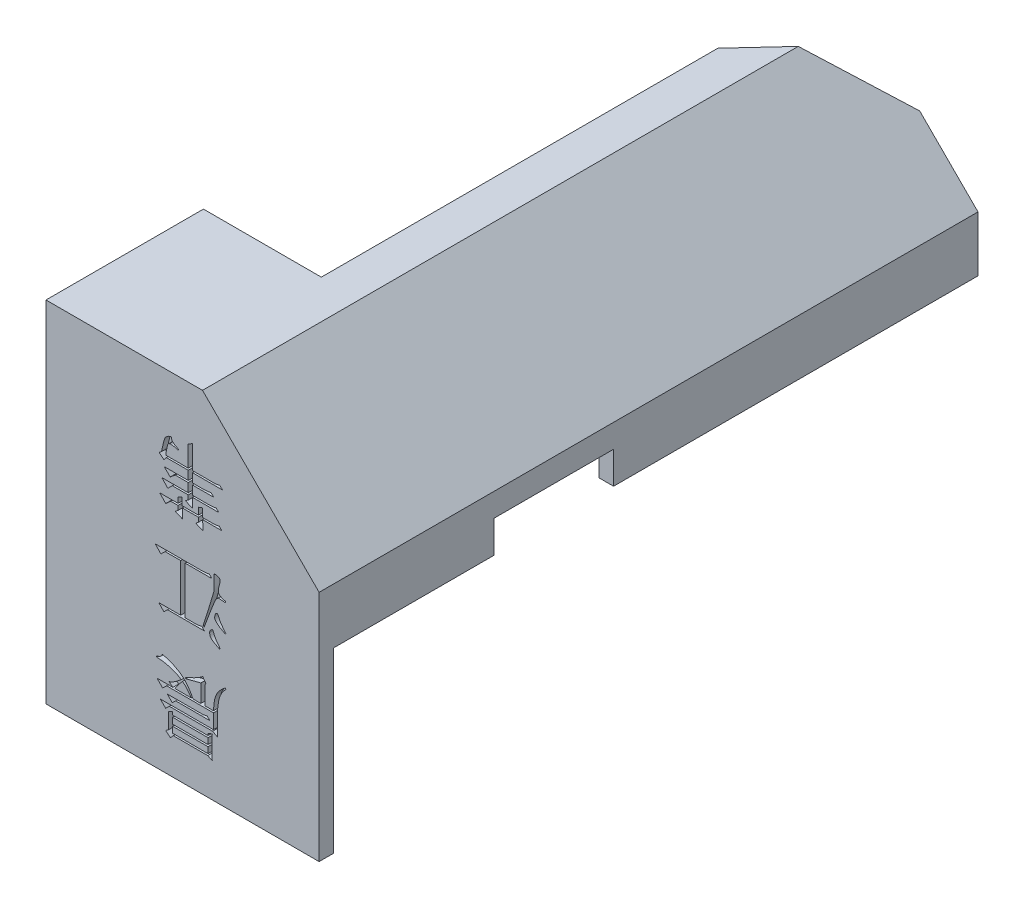
from build123d import *

# Parameters (mm, degrees)
EXTRUDE_1_DEPTH     = 10
CUT_EXTRUDE_1_DEPTH = 200
EXTRUDE_2_DEPTH     = 200
CUT_EXTRUDE_2_DEPTH = 200
SKETCH_6_W          = 16.619995117
SKETCH_6_H          = 27
EXTRUDE_3_DEPTH     = 10
SKETCH_7_W          = 3.6
SKETCH_7_H          = 27
EXTRUDE_4_DEPTH     = 20
CUT_EXTRUDE_3_DEPTH = 200
EXTRUDE_5_DEPTH     = 200
SKETCH_10_W         = 10.760009765
SKETCH_10_H         = 87
CUT_EXTRUDE_4_DEPTH = 200
CUT_EXTRUDE_5_DEPTH = 200
SKETCH_13_W         = 46.839990234
SKETCH_13_H         = 2.5
EXTRUDE_6_DEPTH     = 40
SKETCH_14_W         = 46.839990234
SKETCH_14_H         = 10
EXTRUDE_7_DEPTH     = 9.5
SKETCH_15_W         = 15
SKETCH_15_H         = 10
EXTRUDE_8_DEPTH     = 9.5
SKETCH_16_W         = 2.5
SKETCH_16_H         = 47.5
SKETCH_16_H_2       = 43
EXTRUDE_9_DEPTH     = 9.5
SKETCH_17_W         = 1.5
SKETCH_17_H         = 5
CUT_EXTRUDE_6_DEPTH = 9.5
SKETCH_18_W         = 2.5
SKETCH_18_H         = 20.5
CUT_EXTRUDE_7_DEPTH = 5.5
SKETCH_20_W         = 6.079056491
SKETCH_20_H         = 1.034164663
SKETCH_20_H_2       = 1.034164664
CUT_EXTRUDE_8_DEPTH = 1


with BuildPart() as part:
    # 草图2 → 凸台-拉伸1 (new body)
    with BuildSketch(Plane(origin=(0, 0, 0), x_dir=(1, 0, 0), z_dir=(0, 1, 0))):
        Polygon((23, -36), (23, -113), (-21, -113), (-21, -86), (-12, -86), (-12, -26.252704718), (12.239990234, 0), (23.04327774, 0), align=None)
    extrude(amount=EXTRUDE_1_DEPTH)

    # 草图3 → 切除-拉伸1 (cut)
    with BuildSketch(Plane(origin=(0, 0, 0), x_dir=(-1, 0, 0), z_dir=(0, 0, -1))):
        Polygon((-12.239990234, 10), (-23.04327774, 0), (-23.04327774, 10), align=None)
    extrude(amount=-CUT_EXTRUDE_1_DEPTH, mode=Mode.SUBTRACT)

    # 草图4 → 凸台-拉伸2 (add)
    with BuildSketch(Plane.XY.offset(113)):
        Polygon((-4.380004883, 10), (12.239990234, 10), (1.479980469, 20), (-4.380004883, 20), align=None)
    extrude(amount=-EXTRUDE_2_DEPTH)

    # 草图5 → 切除-拉伸2 (cut)
    with BuildSketch(Plane.XZ):
        Polygon((-4.380004883, 18), (12.239990234, 0), (12.239990234, -87), (-4.380004883, -87), align=None)
    extrude(amount=-CUT_EXTRUDE_2_DEPTH, mode=Mode.SUBTRACT)

    # 草图6 → 凸台-拉伸3 (add)
    with BuildSketch(Plane(origin=(0, 10, 0), x_dir=(1, 0, 0), z_dir=(0, 1, 0))):
        with Locations((-12.690002442, -99.5)):
            Rectangle(SKETCH_6_W, SKETCH_6_H)
    extrude(amount=EXTRUDE_3_DEPTH)

    # 草图7 → 凸台-拉伸4 (add)
    with BuildSketch(Plane(origin=(0, 0, 0), x_dir=(-1, 0, 0), z_dir=(0, -1, 0))):
        with Locations((22.8, -99.5)):
            Rectangle(SKETCH_7_W, SKETCH_7_H)
    extrude(amount=-EXTRUDE_4_DEPTH)

    # 草图8 → 切除-拉伸3 (cut)
    with BuildSketch(Plane(origin=(0, 0, 0), x_dir=(-1, 0, 0), z_dir=(0, 0, -1))):
        Polygon((-22.239990234, 0), (-12.239990234, 10), (-23.04327774, 0), align=None)
    extrude(amount=-CUT_EXTRUDE_3_DEPTH, mode=Mode.SUBTRACT)

    # 草图9 → 凸台-拉伸5 (add)
    with BuildSketch(Plane(origin=(0, 0, 0), x_dir=(-1, 0, 0), z_dir=(0, 0, -1))):
        Polygon((-2.239990234, 20), (-12.239990234, 10), (-1.479980469, 20), align=None)
    extrude(amount=-EXTRUDE_5_DEPTH)

    # 草图10 → 切除-拉伸4 (cut)
    with BuildSketch(Plane.XZ):
        with Locations((6.859985352, 156.5)):
            Rectangle(SKETCH_10_W, SKETCH_10_H)
    extrude(amount=-CUT_EXTRUDE_4_DEPTH, mode=Mode.SUBTRACT)

    # 草图12 → 切除-拉伸5 (cut)
    with BuildSketch(Plane.XZ):
        Polygon((12.239990234, 0), (1.479980469, 0), (1.479980469, 11.653443603), align=None)
    extrude(amount=-CUT_EXTRUDE_5_DEPTH, mode=Mode.SUBTRACT)

    # 草图13 → 凸台-拉伸6 (add)
    with BuildSketch(Plane.XZ):
        with Locations((-1.180004883, 111.75)):
            Rectangle(SKETCH_13_W, SKETCH_13_H)
    extrude(amount=EXTRUDE_6_DEPTH)

    # 草图14 → 凸台-拉伸7 (add)
    with BuildSketch(Plane.XZ):
        with Locations((-1.180004883, 105.5)):
            Rectangle(SKETCH_14_W, SKETCH_14_H)
    extrude(amount=EXTRUDE_7_DEPTH)

    # 草图15 → 凸台-拉伸8 (add)
    with BuildSketch(Plane.XZ):
        with Locations((14.739990234, 48)):
            Rectangle(SKETCH_15_W, SKETCH_15_H)
    extrude(amount=EXTRUDE_8_DEPTH)

    # 草图16 → 凸台-拉伸9 (add)
    with BuildSketch(Plane.XZ):
        with Locations((20.989990234, 76.75)):
            Rectangle(SKETCH_16_W, SKETCH_16_H)
        with Locations((20.989990234, 21.5)):
            Rectangle(SKETCH_16_W, SKETCH_16_H_2)
    extrude(amount=EXTRUDE_9_DEPTH)

    # 草图17 → 切除-拉伸6 (cut)
    with BuildSketch(Plane.XZ.offset(9.5)):
        with Locations((20.489990234, 2.5)):
            Rectangle(SKETCH_17_W, SKETCH_17_H)
    extrude(amount=-CUT_EXTRUDE_6_DEPTH, mode=Mode.SUBTRACT)

    # 草图18 → 切除-拉伸7 (cut)
    with BuildSketch(Plane(origin=(0, -9.5, 0), x_dir=(-1, 0, 0), z_dir=(0, -1, 0))):
        with Locations((-20.989990234, -72.75)):
            Rectangle(SKETCH_18_W, SKETCH_18_H)
    extrude(amount=-CUT_EXTRUDE_7_DEPTH, mode=Mode.SUBTRACT)

    # 草图20 → 切除-拉伸8 (cut)
    # profile 1 of 9: a face of its own
    with BuildSketch(Plane.XY.offset(113)):
        with BuildLine():
            Line((-1.957855817, 1.113671032), (-1.957855817, 2.092502162))
            Line((-1.957855817, 2.092502162), (-1.236611827, 2.401606729))
            Line((-1.236611827, 2.401606729), (-1.236611827, 1.113671032))
            Line((-1.236611827, 1.113671032), (1.545329279, 1.113671032))
            Line((1.545329279, 1.113671032), (1.545329279, 2.298571873))
            Line((1.545329279, 2.298571873), (2.26657327, 2.556159013))
            Line((2.26657327, 2.556159013), (2.26657327, 1.113671032))
            Line((2.26657327, 1.113671032), (3.863613534, 1.113671032))
            add(Edge.make_bspline(
                [(3.863613534, 1.113671032), (3.973067336, 1.115494854), (4.188542389, 1.119085303), (4.504865126, 1.147595553), (4.808234957, 1.197119636), (5.0036207, 1.244730313), (5.100031803, 1.268223316)],
                knots=[0, 0, 0, 0, 1.051063684, 2.069165233, 3.04724927, 4, 4, 4, 4], degree=3))
            Line((5.100031803, 1.268223316), (5.563688654, 0.804566465))
            Line((5.563688654, 0.804566465), (2.26657327, 0.804566465))
            add(Edge.make_bspline(
                [(2.26657327, 0.804566465), (2.269095531, 0.534835012), (2.274225696, -0.013786449), (2.303307204, -0.561663521), (2.318090697, -0.840175122)],
                knots=[0, 0, 0, 0, 0.98330624, 2, 2, 2, 2], degree=3))
            Line((2.318090697, -0.840175122), (1.081672428, -0.30973642))
            Line((1.081672428, -0.30973642), (1.545329279, 0.062333893))
            Line((1.545329279, 0.062333893), (1.545329279, 0.804566465))
            Line((1.545329279, 0.804566465), (-1.236611827, 0.804566465))
            add(Edge.make_bspline(
                [(-1.236611827, 0.804566465), (-1.234089565, 0.534835012), (-1.2289594, -0.013786449), (-1.199877892, -0.561663521), (-1.185094399, -0.840175122)],
                knots=[0, 0, 0, 0, 0.98330624, 2, 2, 2, 2], degree=3))
            Line((-1.185094399, -0.840175122), (-2.421512668, -0.30973642))
            Line((-2.421512668, -0.30973642), (-1.957855817, 0.062333893))
            Line((-1.957855817, 0.062333893), (-1.957855817, 0.804566465))
            Line((-1.957855817, 0.804566465), (-3.194274086, 0.804566465))
            Line((-3.194274086, 0.804566465), (-4.07007036, 0.031805046))
            Line((-4.07007036, 0.031805046), (-5.100418918, 1.113671032))
            Line((-5.100418918, 1.113671032), (-1.957855817, 1.113671032))
        make_face()
    # profile 2 of 9: a face of its own
    with BuildSketch(Plane.XY.offset(113)):
        with BuildLine():
            add(Edge.make_bspline(
                [(-0.206263269, 7.219440263), (-0.205870723, 7.433779465), (-0.205119405, 7.844017379), (-0.210217646, 8.431053974), (-0.213258354, 8.961502492), (-0.218651091, 9.435352439), (-0.227179841, 9.852551152), (-0.233019268, 10.213264847), (-0.245196914, 10.51724242), (-0.253875898, 10.701005451), (-0.257780697, 10.783683051)],
                knots=[0, 0, 0, 0, 1.442975, 2.761804882, 3.952183016, 5.014153289, 5.952029349, 6.761475481, 7.442770207, 8, 8, 8, 8], degree=3))
            Line((-0.257780697, 10.783683051), (0.566498149, 11.249247955))
            add(Edge.make_bspline(
                [(0.566498149, 11.249247955), (0.562689346, 11.122680818), (0.554727523, 10.858108227), (0.54210012, 10.443474928), (0.536114344, 9.993108749), (0.527597456, 9.507215646), (0.522046289, 8.985670372), (0.519025417, 8.428509185), (0.513872982, 7.835749029), (0.514604619, 7.428691283), (0.514980722, 7.219440263)],
                knots=[0, 0, 0, 0, 0.7540346, 1.576213955, 2.470168138, 3.436073309, 4.47009525, 5.576041255, 6.753946228, 8, 8, 8, 8], degree=3))
            Line((0.514980722, 7.219440263), (3.96664839, 7.219440263))
            add(Edge.make_bspline(
                [(3.96664839, 7.219440263), (4.076102192, 7.221264085), (4.291577245, 7.224854534), (4.607899982, 7.253364784), (4.911269813, 7.302888867), (5.106655556, 7.350499544), (5.203066659, 7.373992546)],
                knots=[0, 0, 0, 0, 1.051063684, 2.069165233, 3.04724927, 4, 4, 4, 4], degree=3))
            Line((5.203066659, 7.373992546), (5.66672351, 6.910335695))
            Line((5.66672351, 6.910335695), (0.514980722, 6.910335695))
            Line((0.514980722, 6.910335695), (0.514980722, 5.387709494))
            Line((0.514980722, 5.387709494), (2.472642981, 5.387709494))
            add(Edge.make_bspline(
                [(2.472642981, 5.387709494), (2.582096784, 5.389533316), (2.797571836, 5.393123764), (3.113894573, 5.421634015), (3.417264404, 5.471158098), (3.612650147, 5.518768774), (3.70906125, 5.542261777)],
                knots=[0, 0, 0, 0, 1.051063684, 2.069165233, 3.04724927, 4, 4, 4, 4], degree=3))
            Line((3.70906125, 5.542261777), (4.172718101, 5.078604926))
            Line((4.172718101, 5.078604926), (0.514980722, 5.078604926))
            Line((0.514980722, 5.078604926), (0.514980722, 3.555978724))
            Line((0.514980722, 3.555978724), (3.348439255, 3.555978724))
            add(Edge.make_bspline(
                [(3.348439255, 3.555978724), (3.457893058, 3.557802547), (3.67336811, 3.561392995), (3.989690847, 3.589903246), (4.293060678, 3.639427329), (4.488446422, 3.687038005), (4.584857524, 3.710531008)],
                knots=[0, 0, 0, 0, 1.051063684, 2.069165233, 3.04724927, 4, 4, 4, 4], degree=3))
            Line((4.584857524, 3.710531008), (5.048514375, 3.246874157))
            Line((5.048514375, 3.246874157), (0.514980722, 3.246874157))
            Line((0.514980722, 3.246874157), (0.514980722, 1.598316465))
            Line((0.514980722, 1.598316465), (-0.721437548, 2.165008171))
            Line((-0.721437548, 2.165008171), (-0.206263269, 2.474112739))
            Line((-0.206263269, 2.474112739), (-0.206263269, 3.246874157))
            Line((-0.206263269, 3.246874157), (-2.936686947, 3.246874157))
            Line((-2.936686947, 3.246874157), (-3.709448365, 2.474112739))
            Line((-3.709448365, 2.474112739), (-4.739796923, 3.555978724))
            Line((-4.739796923, 3.555978724), (-0.206263269, 3.555978724))
            Line((-0.206263269, 3.555978724), (-0.206263269, 5.078604926))
            Line((-0.206263269, 5.078604926), (-2.421512668, 5.078604926))
            Line((-2.421512668, 5.078604926), (-3.297308942, 4.357360936))
            Line((-3.297308942, 4.357360936), (-4.3276575, 5.387709494))
            Line((-4.3276575, 5.387709494), (-0.206263269, 5.387709494))
            Line((-0.206263269, 5.387709494), (-0.206263269, 6.910335695))
            Line((-0.206263269, 6.910335695), (-3.967035504, 6.910335695))
            Line((-3.967035504, 6.910335695), (-4.379174928, 6.395161417))
            Line((-4.379174928, 6.395161417), (-5.203453774, 7.064887979))
            Line((-5.203453774, 7.064887979), (-4.791314351, 7.373992546))
            add(Edge.make_bspline(
                [(-4.791314351, 7.373992546), (-4.762188337, 7.533783173), (-4.706845462, 7.837404285), (-4.616277009, 8.267126012), (-4.529950112, 8.649351182), (-4.442292905, 8.982659269), (-4.357905358, 9.26857651), (-4.272140077, 9.505411195), (-4.191108098, 9.696211656), (-4.103897825, 9.843655548), (-4.00912782, 9.958389637), (-3.909624168, 10.059101335), (-3.798268819, 10.146672934), (-3.677438605, 10.223330121), (-3.546532521, 10.289014907), (-3.404119408, 10.341490402), (-3.252142391, 10.386739086), (-3.145554374, 10.404480247), (-3.09123923, 10.413520792)],
                knots=[0, 0, 0, 0, 2.069553596, 3.932396895, 5.595591764, 7.062035983, 8.32345808, 9.392529406, 10.270536713, 10.961312947, 11.566325101, 12.162313655, 12.762256471, 13.367051464, 13.983197271, 14.624416805, 15.299030042, 16, 16, 16, 16], degree=3))
            add(Edge.make_bspline(
                [(-3.09123923, 10.413520792), (-3.091534706, 10.35469322), (-3.092126804, 10.236809591), (-3.041065968, 10.063490087), (-2.950854029, 9.899876078), (-2.818047606, 9.747794176), (-2.648636882, 9.602425738), (-2.437097764, 9.467477897), (-2.186699224, 9.340417545), (-2.003037868, 9.267180148), (-1.906338389, 9.22861995)],
                knots=[0, 0, 0, 0, 0.782883342, 1.568807377, 2.383007473, 3.263648648, 4.252173226, 5.358096433, 6.609012229, 8, 8, 8, 8], degree=3))
            Line((-1.906338389, 9.22861995), (-1.906338389, 9.022550239))
            add(Edge.make_bspline(
                [(-1.906338389, 9.022550239), (-1.976827784, 9.043290396), (-2.11229015, 9.083147607), (-2.309726039, 9.13452432), (-2.492304771, 9.178383921), (-2.660798556, 9.215174813), (-2.814818914, 9.243615133), (-2.95400287, 9.265532793), (-3.078940634, 9.277465398), (-3.157364849, 9.279282286), (-3.194274086, 9.280137378)],
                knots=[0, 0, 0, 0, 1.338869655, 2.5729608, 3.717076463, 4.760487723, 5.715229524, 6.570842299, 7.327387319, 8, 8, 8, 8], degree=3))
            add(Edge.make_bspline(
                [(-3.194274086, 9.280137378), (-3.235872356, 9.278090956), (-3.317390026, 9.274080704), (-3.434128911, 9.237823527), (-3.541002875, 9.181056173), (-3.62840401, 9.113308718), (-3.688729864, 9.018567802), (-3.735796521, 8.90038207), (-3.783035318, 8.735412133), (-3.836566406, 8.524168734), (-3.893523373, 8.266000472), (-3.949367168, 7.958854353), (-4.010796986, 7.605369563), (-4.049545142, 7.353080085), (-4.07007036, 7.219440263)],
                knots=[0, 0, 0, 0, 0.615964337, 1.207068884, 1.793788658, 2.409969795, 2.818244734, 3.443961849, 4.291755925, 5.362843938, 6.67702707, 8.21313856, 9.994068186, 12, 12, 12, 12], degree=3))
            Line((-4.07007036, 7.219440263), (-0.206263269, 7.219440263))
        make_face()
    # profile 3 of 9: a face of its own
    with BuildSketch(Plane.XY.offset(113)):
        with BuildLine():
            Line((2.575677837, -15.581971997), (-3.760965793, -15.581971997))
            Line((-3.760965793, -15.581971997), (-4.379174928, -16.200181131))
            Line((-4.379174928, -16.200181131), (-5.254971202, -15.27286743))
            Line((-5.254971202, -15.27286743), (-1.494198966, -15.27286743))
            Line((-1.494198966, -15.27286743), (-1.494198966, -7.156010458))
            Line((-1.494198966, -7.156010458), (-4.173105216, -7.156010458))
            Line((-4.173105216, -7.156010458), (-4.894349206, -7.877254449))
            Line((-4.894349206, -7.877254449), (-5.873180336, -6.846905891))
            Line((-5.873180336, -6.846905891), (2.163538414, -6.846905891))
            add(Edge.make_bspline(
                [(2.163538414, -6.846905891), (2.272992216, -6.845082069), (2.488467269, -6.84149162), (2.804790006, -6.81298137), (3.108159837, -6.763457287), (3.30354558, -6.71584661), (3.399956683, -6.692353607)],
                knots=[0, 0, 0, 0, 1.051063684, 2.069165233, 3.04724927, 4, 4, 4, 4], degree=3))
            Line((3.399956683, -6.692353607), (3.863613534, -7.156010458))
            Line((3.863613534, -7.156010458), (-0.721437548, -7.156010458))
            Line((-0.721437548, -7.156010458), (-0.721437548, -15.27286743))
            Line((-0.721437548, -15.27286743), (0.875602717, -15.27286743))
            add(Edge.make_bspline(
                [(0.875602717, -15.27286743), (0.985056519, -15.271043607), (1.200531572, -15.267453159), (1.516854309, -15.238942908), (1.82022414, -15.189418825), (2.015609883, -15.141808149), (2.112020986, -15.118315146)],
                knots=[0, 0, 0, 0, 1.051063684, 2.069165233, 3.04724927, 4, 4, 4, 4], degree=3))
            Line((2.112020986, -15.118315146), (2.575677837, -15.581971997))
        make_face()
    # profile 4 of 9: a face of its own
    with BuildSketch(Plane.XY.offset(113)):
        with BuildLine():
            add(Edge.make_bspline(
                [(2.318090697, -14.994291708), (2.38294259, -14.789487096), (2.508820791, -14.391959204), (2.692626711, -13.812747208), (2.864342424, -13.267676165), (3.023292276, -12.756336418), (3.176294289, -12.281070879), (3.31140346, -11.838564548), (3.441178154, -11.431681475), (3.555565234, -11.05814879), (3.664777937, -10.720285258), (3.756183521, -10.415224562), (3.841251925, -10.146095393), (3.913546773, -9.911338443), (3.975091485, -9.710501499), (4.024431287, -9.543778474), (4.062203738, -9.411187876), (4.118858521, -9.223882149), (4.179914, -8.953709815), (4.230157763, -8.577029318), (4.253964134, -8.165070936), (4.251499583, -7.804675035), (4.243777918, -7.513423258), (4.236775208, -7.307937881), (4.22549642, -7.120461793), (4.2205604, -6.950375766), (4.206657981, -6.798639029), (4.198794655, -6.664222237), (4.187549544, -6.547088834), (4.177399447, -6.47544272), (4.172718101, -6.44239868)],
                knots=[0, 0, 0, 0, 2.041628327, 3.962821916, 5.775108532, 7.472727231, 9.05172884, 10.520019874, 11.869679094, 13.110441154, 14.232578046, 15.244025837, 16.136825906, 16.914965052, 17.578451722, 18.133093711, 18.567327515, 18.888651229, 19.992735604, 21.194623739, 22.496553661, 23.910954667, 24.618387611, 25.26559539, 25.864758518, 26.403257503, 26.88214419, 27.312362898, 27.682853586, 28, 28, 28, 28], degree=3))
            add(Edge.make_bspline(
                [(4.172718101, -6.44239868), (4.174664552, -6.411517566), (4.17835846, -6.352912446), (4.235348545, -6.280343758), (4.324702378, -6.241686223), (4.392359044, -6.238253986), (4.430305241, -6.236328968)],
                knots=[0, 0, 0, 0, 0.970945968, 1.84262797, 2.790007448, 4, 4, 4, 4], degree=3))
            add(Edge.make_bspline(
                [(4.430305241, -6.236328968), (4.466618857, -6.237509824), (4.544772024, -6.240051229), (4.667417604, -6.260113084), (4.80281703, -6.294346791), (4.944707765, -6.335616648), (5.083440092, -6.395893276), (5.186137819, -6.503477639), (5.246114802, -6.644284366), (5.251632113, -6.747693042), (5.254584087, -6.803020675)],
                knots=[0, 0, 0, 0, 0.77261931, 1.662810053, 2.637871204, 3.7425274, 4.814010223, 5.809618849, 6.82806154, 8, 8, 8, 8], degree=3))
            add(Edge.make_bspline(
                [(5.254584087, -6.803020675), (5.252306567, -6.851445634), (5.247212152, -6.959763796), (5.216308247, -7.137147772), (5.164875549, -7.345889789), (5.122778928, -7.49513609), (5.100031803, -7.575782093)],
                knots=[0, 0, 0, 0, 0.735604743, 1.64541913, 2.727690164, 4, 4, 4, 4], degree=3))
            add(Edge.make_bspline(
                [(5.100031803, -7.575782093), (5.077073764, -7.657011085), (5.03371759, -7.810411743), (4.983198155, -8.029045256), (4.952252033, -8.223000331), (4.947623773, -8.344001557), (4.94547952, -8.400060939)],
                knots=[0, 0, 0, 0, 1.204024663, 2.273796248, 3.200256724, 4, 4, 4, 4], degree=3))
            add(Edge.make_bspline(
                [(4.94547952, -8.400060939), (4.948562598, -8.45689577), (4.954508321, -8.56650187), (4.995768991, -8.722481949), (5.070845323, -8.857676378), (5.157292572, -8.954651632), (5.246096974, -9.022350488), (5.330461802, -9.072859445), (5.430822946, -9.125198393), (5.548705232, -9.175285558), (5.682857458, -9.227189941), (5.83384932, -9.278290977), (6.001824663, -9.329842811), (6.120106229, -9.362060961), (6.181897789, -9.378892069)],
                knots=[0, 0, 0, 0, 1.186568634, 2.288300306, 3.334287329, 4.387414279, 4.974386682, 5.659881239, 6.437904005, 7.335861965, 8.332118144, 9.440710278, 10.662999569, 12, 12, 12, 12], degree=3))
            Line((6.181897789, -9.378892069), (6.181897789, -9.584961781))
            add(Edge.make_bspline(
                [(6.181897789, -9.584961781), (6.10810503, -9.577478313), (5.968137355, -9.563283918), (5.769330787, -9.540816767), (5.591746953, -9.526192781), (5.435922056, -9.514358363), (5.301728435, -9.506980045), (5.189064765, -9.501439788), (5.098164711, -9.504966295), (5.002951322, -9.506263407), (4.890748722, -9.545144076), (4.763429547, -9.641179182), (4.634913342, -9.789252211), (4.531357324, -9.926214628), (4.460164944, -10.05332253), (4.407899538, -10.157013121), (4.344348858, -10.293594622), (4.273572728, -10.464095107), (4.186430609, -10.665280472), (4.092142267, -10.901602618), (3.983024153, -11.168707159), (3.864866453, -11.469862428), (3.734809445, -11.802776366), (3.596794457, -12.17009771), (3.442431253, -12.568381123), (3.28206096, -13.001164931), (3.107186696, -13.465628269), (2.922890327, -13.963287479), (2.725779877, -14.493277932), (2.592651816, -14.858110794), (2.524160409, -15.045809136)],
                knots=[0, 0, 0, 0, 0.850636125, 1.61345859, 2.294319225, 2.894038098, 3.405461157, 3.836062876, 4.186257789, 4.449251912, 4.924436183, 5.51544197, 6.258800839, 7.167792912, 7.478115691, 7.928289117, 8.499379183, 9.205254928, 10.045222473, 11.013697011, 12.123030655, 13.354272756, 14.723727765, 16.222013246, 17.854354153, 19.622398231, 21.515084692, 23.546081591, 25.708558668, 28, 28, 28, 28], degree=3))
            Line((2.524160409, -15.045809136), (2.318090697, -14.994291708))
        make_face()
    # profile 5 of 9: a face of its own
    with BuildSketch(Plane.XY.offset(113)):
        with BuildLine():
            add(Edge.make_bspline(
                [(6.130380361, -14.242518872), (5.989172102, -14.169302082), (5.722443384, -14.03100266), (5.355413607, -13.817507428), (5.043709143, -13.614797164), (4.788072416, -13.423013895), (4.586874746, -13.241993667), (4.44257455, -13.069060068), (4.350332875, -12.904055126), (4.321558158, -12.744947475), (4.33023535, -12.603209073), (4.341552636, -12.473511272), (4.365308723, -12.356275086), (4.39470203, -12.250159482), (4.435441792, -12.156447391), (4.482167472, -12.072895763), (4.540988785, -12.003231314), (4.605432989, -11.946169342), (4.674886243, -11.908571026), (4.747777389, -11.895256406), (4.817789441, -11.920722798), (4.882499594, -11.973852075), (4.939630273, -12.057289287), (4.997370135, -12.165940048), (5.051448825, -12.303962425), (5.082980911, -12.40673275), (5.100031803, -12.462305531)],
                knots=[0, 0, 0, 0, 2.771839315, 5.235735886, 7.397052885, 9.248230513, 10.801433544, 12.101560326, 13.162511207, 14.053847697, 14.874414825, 15.632157465, 16.321283385, 16.956214998, 17.547144772, 18.098490081, 18.6179356, 19.128914895, 19.589963686, 19.981866916, 20.377980089, 20.843669315, 21.422307499, 22.126513003, 22.986916886, 24, 24, 24, 24], degree=3))
            add(Edge.make_bspline(
                [(5.100031803, -12.462305531), (5.124018725, -12.519294178), (5.174173477, -12.638452922), (5.269845112, -12.817811325), (5.381496757, -13.008192181), (5.514563585, -13.206669798), (5.665258917, -13.415405055), (5.83790043, -13.631393452), (6.026393342, -13.860013272), (6.162852402, -14.01152705), (6.233415217, -14.089874641)],
                knots=[0, 0, 0, 0, 0.744234975, 1.556136334, 2.445417578, 3.401334143, 4.432387501, 5.544831445, 6.73043532, 8, 8, 8, 8], degree=3))
            Line((6.233415217, -14.089874641), (6.130380361, -14.242518872))
        make_face()
    # profile 6 of 9: a face of its own
    with BuildSketch(Plane.XY.offset(113)):
        with BuildLine():
            add(Edge.make_bspline(
                [(5.151549231, -16.982482814), (5.038168299, -16.924305099), (4.823762951, -16.814290011), (4.523136951, -16.653615891), (4.265315448, -16.500470292), (4.047130959, -16.360748816), (3.87017312, -16.231078099), (3.73326863, -16.114043446), (3.634981205, -16.007888874), (3.565133834, -15.882022781), (3.527405676, -15.741945619), (3.485127621, -15.600923949), (3.457443167, -15.485080817), (3.453270808, -15.415433855), (3.451474111, -15.38544255)],
                knots=[0, 0, 0, 0, 1.862120743, 3.521303265, 4.979660765, 6.242746529, 7.305940544, 8.181941532, 8.873474902, 9.406045829, 10.26713084, 10.98200017, 11.561629937, 12, 12, 12, 12], degree=3))
            add(Edge.make_bspline(
                [(3.451474111, -15.38544255), (3.453531611, -15.343193024), (3.457593456, -15.259785473), (3.494589937, -15.139251052), (3.550280836, -15.024512855), (3.627033432, -14.922125271), (3.709856152, -14.836310423), (3.784938538, -14.771076695), (3.851154776, -14.726545102), (3.895628862, -14.719017067), (3.915130962, -14.715715987)],
                knots=[0, 0, 0, 0, 1.168312405, 2.306441898, 3.465406586, 4.688940877, 5.836046079, 6.761526913, 7.456923602, 8, 8, 8, 8], degree=3))
            add(Edge.make_bspline(
                [(3.915130962, -14.715715987), (3.928155621, -14.717358332), (3.956952201, -14.720989437), (3.996935414, -14.748683122), (4.035114297, -14.79035617), (4.073609871, -14.846998286), (4.110741369, -14.920700697), (4.151003213, -15.009318966), (4.188332204, -15.11503342), (4.211792426, -15.190737474), (4.224235529, -15.230890266)],
                knots=[0, 0, 0, 0, 0.496913912, 1.098640786, 1.805173847, 2.66343683, 3.709637392, 4.963810336, 6.389630587, 8, 8, 8, 8], degree=3))
            add(Edge.make_bspline(
                [(4.224235529, -15.230890266), (4.247763508, -15.28841367), (4.296495292, -15.407557697), (4.385116968, -15.587230803), (4.490906335, -15.774678623), (4.612734973, -15.969524736), (4.749112054, -16.173467582), (4.902304008, -16.385028616), (5.071004571, -16.605629882), (5.192403138, -16.752634192), (5.254584087, -16.827930531)],
                knots=[0, 0, 0, 0, 0.781446964, 1.618554035, 2.517469339, 3.487458335, 4.507978227, 5.602435508, 6.771955557, 8, 8, 8, 8], degree=3))
            Line((5.254584087, -16.827930531), (5.151549231, -16.982482814))
        make_face()
    # profile 7 of 9: a face of its own
    with BuildSketch(Plane.XY.offset(113)):
        with BuildLine():
            Line((4.121200673, -29.461328968), (4.121200673, -26.961779689))
            Line((4.121200673, -26.961779689), (-3.915518077, -26.961779689))
            Line((-3.915518077, -26.961779689), (-4.585244639, -27.631506252))
            Line((-4.585244639, -27.631506252), (-5.564075769, -26.652675122))
            Line((-5.564075769, -26.652675122), (-2.833652091, -26.652675122))
            Line((-2.833652091, -26.652675122), (-3.503378653, -26.137500843))
            add(Edge.make_bspline(
                [(-3.503378653, -26.137500843), (-3.426643984, -26.110570785), (-3.273832737, -26.056941627), (-3.052386239, -25.957857973), (-2.835949129, -25.849420258), (-2.658644585, -25.74679796), (-2.513161399, -25.651184928), (-2.389743859, -25.569019984), (-2.256469546, -25.469233777), (-2.10709368, -25.362299849), (-1.946974171, -25.238258669), (-1.771625835, -25.104968294), (-1.586893354, -24.953913548), (-1.45806475, -24.851322964), (-1.39116411, -24.798047718)],
                knots=[0, 0, 0, 0, 1.163015581, 2.31605691, 3.467697107, 4.625718426, 5.244075929, 5.958306236, 6.746389769, 7.625459454, 8.586383478, 9.643833778, 10.77644388, 12, 12, 12, 12], degree=3))
            add(Edge.make_bspline(
                [(-1.39116411, -24.798047718), (-1.453777495, -24.755536495), (-1.581550863, -24.66878504), (-1.784590258, -24.545772156), (-2.004269384, -24.431070081), (-2.237559409, -24.317064842), (-2.487520763, -24.21097126), (-2.752811368, -24.110661112), (-3.032552755, -24.012670438), (-3.421375478, -23.889873987), (-3.910941454, -23.759166212), (-4.492852492, -23.645827059), (-5.059275228, -23.575957727), (-5.432234418, -23.566351956), (-5.615593197, -23.561629449)],
                knots=[0, 0, 0, 0, 0.611020613, 1.246892538, 1.915396286, 2.611326531, 3.342947546, 4.106890539, 4.901079045, 5.735885811, 7.398804562, 8.989081481, 10.519735248, 12, 12, 12, 12], degree=3))
            Line((-5.615593197, -23.561629449), (-5.615593197, -23.355559737))
            add(Edge.make_bspline(
                [(-5.615593197, -23.355559737), (-5.549765644, -23.341527424), (-5.424298494, -23.31478187), (-5.248396343, -23.256860666), (-5.093044316, -23.187665522), (-4.959003893, -23.102359682), (-4.845606153, -23.004876653), (-4.751686678, -22.895186826), (-4.681549962, -22.770237379), (-4.651836278, -22.680062737), (-4.636762067, -22.634315747)],
                knots=[0, 0, 0, 0, 1.255284546, 2.392569207, 3.449534634, 4.420859121, 5.346510379, 6.230990395, 7.102554087, 8, 8, 8, 8], degree=3))
            add(Edge.make_bspline(
                [(-4.636762067, -22.634315747), (-4.51627478, -22.661830073), (-4.275249144, -22.716870386), (-3.91730073, -22.819772919), (-3.560337432, -22.9353148), (-3.205097841, -23.06914317), (-2.851909793, -23.220988495), (-2.499377991, -23.38592947), (-2.149176696, -23.56888428), (-1.798784794, -23.764937617), (-1.45414605, -23.990592185), (-1.121106068, -24.254537143), (-0.802655938, -24.560958408), (-0.492795166, -24.902341334), (-0.197516136, -25.284850617), (0.089288241, -25.703531269), (0.364261475, -26.16185169), (0.53202198, -26.486342155), (0.618015577, -26.652675122)],
                knots=[0, 0, 0, 0, 0.861861125, 1.724087504, 2.596659336, 3.478273139, 4.370647251, 5.277545981, 6.192223085, 7.125967882, 8.077044394, 9.062219339, 10.085123993, 11.156101191, 12.275072974, 13.452614483, 14.694216817, 16, 16, 16, 16], degree=3))
            Line((0.618015577, -26.652675122), (1.957468702, -26.652675122))
            Line((1.957468702, -26.652675122), (1.957468702, -23.599790506))
            Line((1.957468702, -23.599790506), (-0.618402692, -24.273333175))
            Line((-0.618402692, -24.273333175), (-0.66992012, -24.118780891))
            add(Edge.make_bspline(
                [(-0.66992012, -24.118780891), (-0.571251317, -24.07444897), (-0.378617291, -23.987898447), (-0.09815335, -23.858070862), (0.167154869, -23.732289182), (0.417586403, -23.609808852), (0.652886624, -23.492078177), (0.874225148, -23.379406905), (1.078960894, -23.268643832), (1.270653619, -23.163511066), (1.447598689, -23.063614275), (1.608571013, -22.965235302), (1.75536584, -22.87246169), (1.887353268, -22.783059449), (2.00318135, -22.696960738), (2.106050833, -22.617440962), (2.191445412, -22.538889972), (2.242592229, -22.486945855), (2.26657327, -22.462590987)],
                knots=[0, 0, 0, 0, 1.533553566, 2.994002063, 4.381478458, 5.696137863, 6.946221177, 8.111684215, 9.217067415, 10.246152141, 11.211350723, 12.097452041, 12.920423487, 13.673221831, 14.356732153, 14.966497679, 15.51542516, 16, 16, 16, 16], degree=3))
            Line((2.26657327, -22.462590987), (2.833264976, -23.290685939))
            add(Edge.make_bspline(
                [(2.833264976, -23.290685939), (2.816776524, -23.305403734), (2.782587941, -23.33592088), (2.74058417, -23.395233675), (2.704018684, -23.466315482), (2.676512519, -23.551591654), (2.653204127, -23.649083538), (2.639310117, -23.759755571), (2.629444048, -23.882640812), (2.627969693, -23.96865673), (2.627195265, -24.013837982)],
                knots=[0, 0, 0, 0, 0.682693637, 1.415555963, 2.234920952, 3.150681089, 4.182789996, 5.336176214, 6.600783439, 8, 8, 8, 8], degree=3))
            Line((2.627195265, -24.013837982), (2.627195265, -26.652675122))
            Line((2.627195265, -26.652675122), (4.121200673, -26.652675122))
            add(Edge.make_bspline(
                [(4.121200673, -26.652675122), (4.126706574, -26.514617029), (4.137424189, -26.245877437), (4.16714676, -25.855572229), (4.211699364, -25.489086927), (4.265745269, -25.14699523), (4.332893702, -24.828668789), (4.409681215, -24.534324676), (4.501544135, -24.264892742), (4.605346608, -24.015459453), (4.729036382, -23.781454374), (4.86699145, -23.55173181), (5.030333301, -23.328490319), (5.207892277, -23.104559828), (5.41047846, -22.886980109), (5.631514383, -22.671855397), (5.872013341, -22.459485129), (6.043195812, -22.325010327), (6.130380361, -22.256521276)],
                knots=[0, 0, 0, 0, 1.314271895, 2.558320817, 3.722244155, 4.825311109, 5.851713781, 6.815889173, 7.71703391, 8.557545078, 9.382894821, 10.232696081, 11.104104102, 12.012127906, 12.949820262, 13.929586754, 14.945522604, 16, 16, 16, 16], degree=3))
            Line((6.130380361, -22.256521276), (6.284932645, -22.411073559))
            add(Edge.make_bspline(
                [(6.284932645, -22.411073559), (6.210126227, -22.48450117), (6.061939334, -22.629956732), (5.859731066, -22.863351855), (5.677236219, -23.106866517), (5.515607278, -23.360249079), (5.372626106, -23.623007324), (5.253650542, -23.896317861), (5.151003408, -24.178319577), (5.042940132, -24.570949867), (4.942257701, -25.082345979), (4.854329987, -25.718844882), (4.800738827, -26.38394732), (4.787428773, -27.080678962), (4.794691896, -27.811515537), (4.803590437, -28.581755025), (4.818474906, -29.393996017), (4.834315157, -29.949166653), (4.842444664, -30.234090386)],
                knots=[0, 0, 0, 0, 0.612733189, 1.213786603, 1.803620884, 2.39063455, 2.969713231, 3.550854244, 4.131995258, 4.723047625, 5.930143292, 7.176647335, 8.47874976, 9.829162569, 11.249841033, 12.752433147, 14.333289246, 16, 16, 16, 16], degree=3))
            Line((4.842444664, -30.234090386), (3.96664839, -29.770433535))
            Line((3.96664839, -29.770433535), (-3.451861226, -29.770433535))
            Line((-3.451861226, -29.770433535), (-4.07007036, -30.38864267))
            Line((-4.07007036, -30.38864267), (-4.997384062, -29.461328968))
            Line((-4.997384062, -29.461328968), (4.121200673, -29.461328968))
        make_face()
        with BuildLine():
            add(Edge.make_bspline(
                [(0.30891101, -26.652675122), (0.249319713, -26.560520389), (0.132788098, -26.38031052), (-0.05246028, -26.125061997), (-0.233732739, -25.883204952), (-0.421068144, -25.662739336), (-0.609107764, -25.459272978), (-0.796963273, -25.272034021), (-0.988047975, -25.103007332), (-1.120251742, -25.002094992), (-1.185094399, -24.952600002)],
                knots=[0, 0, 0, 0, 1.157122963, 2.262770124, 3.325256553, 4.343813707, 5.312101841, 6.246458264, 7.139931436, 8, 8, 8, 8], degree=3))
            add(Edge.make_bspline(
                [(-1.185094399, -24.952600002), (-1.25585393, -25.032595265), (-1.394441433, -25.189271594), (-1.594938547, -25.421433103), (-1.781184512, -25.646603927), (-1.95647358, -25.862240641), (-2.115455821, -26.072414672), (-2.264495362, -26.27214411), (-2.401597065, -26.463219691), (-2.48430631, -26.590667086), (-2.524547524, -26.652675122)],
                knots=[0, 0, 0, 0, 1.183140506, 2.317263606, 3.398018913, 4.420277862, 5.395463474, 6.317073486, 7.181191834, 8, 8, 8, 8], degree=3))
            Line((-2.524547524, -26.652675122), (0.30891101, -26.652675122))
        make_face(mode=Mode.SUBTRACT)
    # profile 8 of 9: a face of its own
    with BuildSketch(Plane.XY.offset(113)):
        with BuildLine():
            Line((3.502991539, -28.427164305), (-2.36999524, -28.427164305))
            Line((-2.36999524, -28.427164305), (-2.936686947, -28.993856011))
            Line((-2.936686947, -28.993856011), (-3.812483221, -28.118059737))
            Line((-3.812483221, -28.118059737), (1.802916419, -28.118059737))
            add(Edge.make_bspline(
                [(1.802916419, -28.118059737), (1.925092521, -28.116366688), (2.157729959, -28.113142927), (2.486897619, -28.085617467), (2.778351756, -28.037750004), (2.955739945, -27.987287886), (3.039334688, -27.963507454)],
                knots=[0, 0, 0, 0, 1.172026276, 2.231673665, 3.166670643, 4, 4, 4, 4], degree=3))
            Line((3.039334688, -27.963507454), (3.502991539, -28.427164305))
        make_face()
    # profile 9 of 9: a face of its own
    with BuildSketch(Plane.XY.offset(113)):
        with BuildLine():
            add(Edge.make_bspline(
                [(3.915130962, -30.186389064), (3.900684544, -30.512611441), (3.871745057, -31.166109641), (3.85945124, -32.151687443), (3.872229895, -33.150588694), (3.900710725, -33.821281977), (3.915130962, -34.160863223)],
                knots=[0, 0, 0, 0, 0.98545974, 1.974101759, 2.974259823, 4, 4, 4, 4], degree=3))
            Line((3.915130962, -34.160863223), (3.142369544, -33.800241228))
            Line((3.142369544, -33.800241228), (-2.782134663, -33.800241228))
            Line((-2.782134663, -33.800241228), (-3.245791514, -34.345944353))
            Line((-3.245791514, -34.345944353), (-4.07007036, -33.668585579))
            Line((-4.07007036, -33.668585579), (-3.554896081, -33.304147478))
            add(Edge.make_bspline(
                [(-3.554896081, -33.304147478), (-3.554496962, -33.134329146), (-3.553737575, -32.811223822), (-3.558832921, -32.350756631), (-3.561876214, -31.939240921), (-3.567186069, -31.576686021), (-3.575765763, -31.263168679), (-3.581527048, -30.998456053), (-3.593482257, -30.782242899), (-3.602474562, -30.654489139), (-3.606413509, -30.598528487)],
                knots=[0, 0, 0, 0, 1.505804279, 2.865022734, 4.083253695, 5.154933375, 6.080121932, 6.864367033, 7.502552716, 8, 8, 8, 8], degree=3))
            Line((-3.606413509, -30.598528487), (-2.885169519, -30.28942392))
            Line((-2.885169519, -30.28942392), (-2.885169519, -30.804598199))
            Line((-2.885169519, -30.804598199), (3.193886972, -30.804598199))
            Line((3.193886972, -30.804598199), (3.193886972, -30.495493631))
            Line((3.193886972, -30.495493631), (3.915130962, -30.186389064))
        make_face()
        with Locations((0.154358726, -32.974054329)):
            Rectangle(SKETCH_20_W, SKETCH_20_H, mode=Mode.SUBTRACT)
        with Locations((0.154358726, -31.630785098)):
            Rectangle(SKETCH_20_W, SKETCH_20_H_2, mode=Mode.SUBTRACT)
    extrude(amount=-CUT_EXTRUDE_8_DEPTH, mode=Mode.SUBTRACT)


solid = part.part
